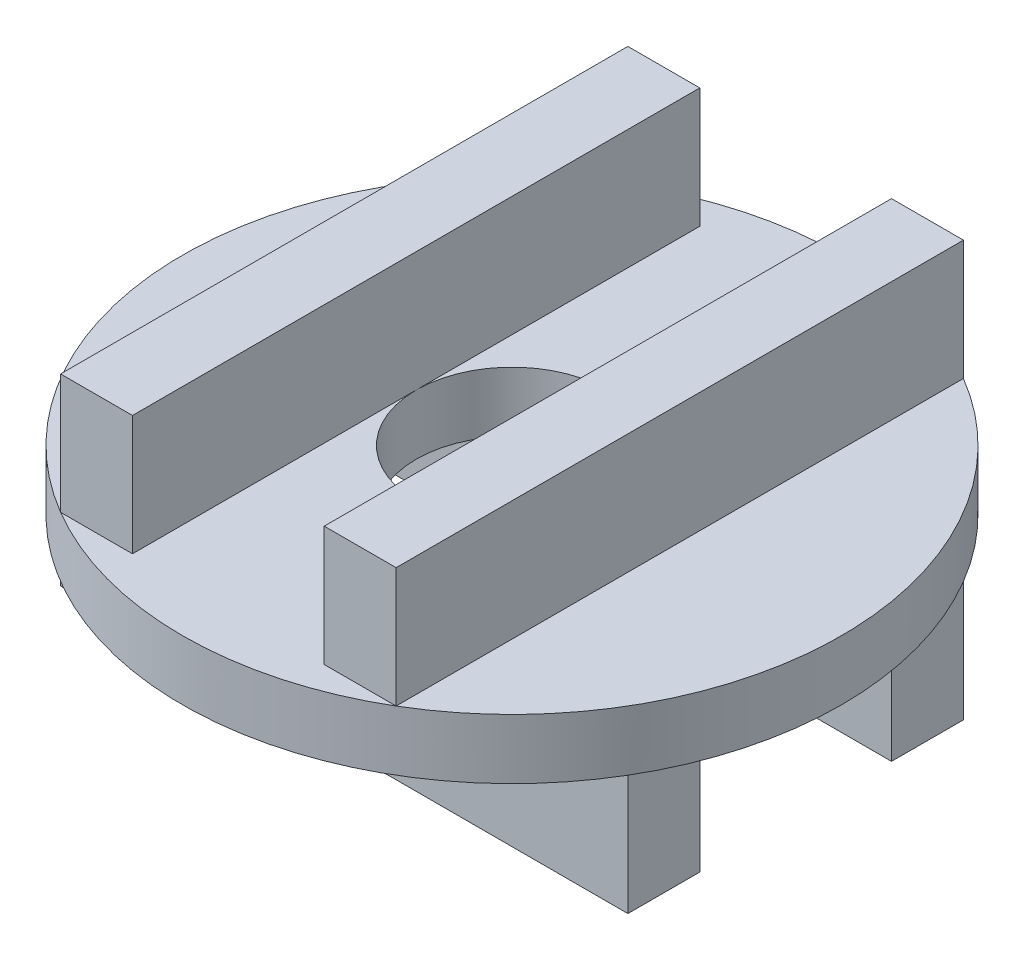
from build123d import *

# Parameters (mm, degrees)
SKETCH1_R           = 55
SKETCH1_R_2         = 16
BOSS_EXTRUDE1_DEPTH = 10
SKETCH2_W           = 12
SKETCH2_H           = 94.678403028
BOSS_EXTRUDE2_DEPTH = 20
SKETCH3_W           = 94.678403028
SKETCH3_H           = 12
BOSS_EXTRUDE3_DEPTH = 20


with BuildPart() as part:
    # Sketch1 → Boss-Extrude1 (new body)
    with BuildSketch(Plane(origin=(0, 0, 0), x_dir=(1, 0, 0), z_dir=(0, 1, 0))):
        with Locations(Location((0, 0, 0), (0, 0, 270))):
            Circle(SKETCH1_R)
        with Locations(Location((0, 0, 0), (0, 0, 270))):
            Circle(SKETCH1_R_2, mode=Mode.SUBTRACT)
    extrude(amount=BOSS_EXTRUDE1_DEPTH)

    # Sketch2 → Boss-Extrude2 (add)
    with BuildSketch(Plane(origin=(0, 10, 0), x_dir=(1, 0, 0), z_dir=(0, 1, 0))):
        with Locations((22, 0)):
            Rectangle(SKETCH2_W, SKETCH2_H)
        with Locations((-22, 0)):
            Rectangle(SKETCH2_W, SKETCH2_H)
    extrude(amount=BOSS_EXTRUDE2_DEPTH)

    # Sketch3 → Boss-Extrude3 (add)
    with BuildSketch(Plane.XZ):
        with Locations((0, 22)):
            Rectangle(SKETCH3_W, SKETCH3_H)
        with Locations((0, -22)):
            Rectangle(SKETCH3_W, SKETCH3_H)
    extrude(amount=BOSS_EXTRUDE3_DEPTH)


solid = part.part
